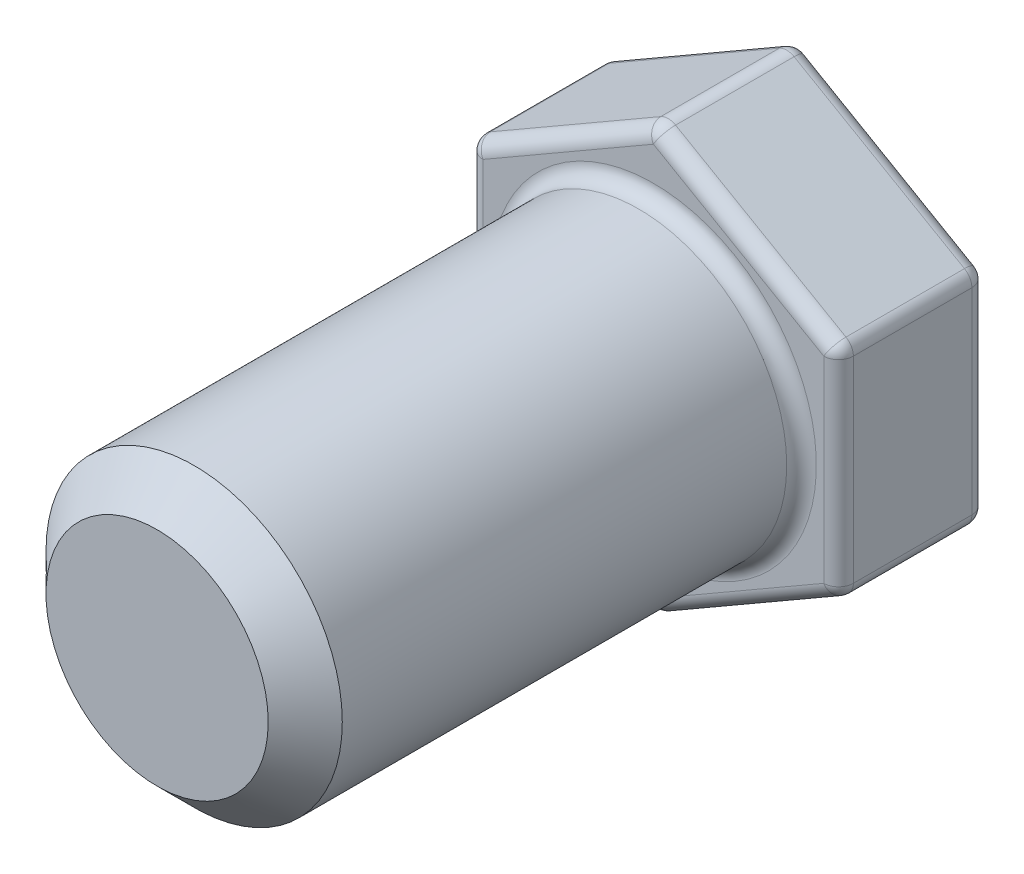
from build123d import *

# Parameters (mm, degrees)
SKETCH1_R           = 2
BOSS_EXTRUDE1_DEPTH = 6.7
BOSS_EXTRUDE2_DEPTH = 2
FILLET1_R           = 0.2
FILLET2_R           = 0.2
CHAMFER1_SIZE       = 0.5


with BuildPart() as part:
    # Sketch1 → Boss-Extrude1 (new body)
    with BuildSketch(Plane.XY):
        Circle(SKETCH1_R)
    extrude(amount=BOSS_EXTRUDE1_DEPTH)

    # Sketch2 → Boss-Extrude2 (add)
    with BuildSketch(Plane(origin=(0, 0, 0), x_dir=(-1, 0, 0), z_dir=(0, 0, -1))):
        Polygon((-2.5, 1.443375673), (-2.5, -1.443375673), (0, -2.886751346), (2.5, -1.443375673), (2.5, 1.443375673), (0, 2.886751346), align=None)
    extrude(amount=BOSS_EXTRUDE2_DEPTH)

    # Fillet1
    fillet1_edges = [part.edges().sort_by_distance(p)[0] for p in [
        (1.25, 2.165063509, 0),
        (2.5, 0, 0),
        (1.25, -2.165063509, 0),
        (-1.25, -2.165063509, 0),
        (-2.5, 0, 0),
        (-1.25, 2.165063509, 0),
        (1.25, 2.165063509, -2),
        (2.5, 0, -2),
        (1.25, -2.165063509, -2),
        (-1.25, -2.165063509, -2),
        (-2.5, 0, -2),
        (-1.25, 2.165063509, -2),
        (-2, 0, 0),
    ]]
    fillet(fillet1_edges, radius=FILLET1_R)

    # Fillet2
    fillet2_edges = [part.edges().sort_by_distance(p)[0] for p in [
        (2.5, -1.443375673, -1),
        (2.5, 1.443375673, -1),
        (0, -2.886751346, -1),
        (-2.5, -1.443375673, -1),
        (-2.5, 1.443375673, -1),
        (0, 2.886751346, -1),
        (-2.436285816, 1.406590271, -0.05362317),
        (-2.436285816, -1.406590271, -0.05362317),
        (0, 2.813180543, -0.05362317),
        (0, -2.813180543, -0.05362317),
        (2.436285816, 1.406590271, -0.05362317),
        (2.436285816, -1.406590271, -0.05362317),
        (0, -2.813180543, -1.94637683),
        (2.436285816, -1.406590271, -1.94637683),
        (-2.436285816, -1.406590271, -1.94637683),
        (2.436285816, 1.406590271, -1.94637683),
        (-2.436285816, 1.406590271, -1.94637683),
        (0, 2.813180543, -1.94637683),
    ]]
    fillet(fillet2_edges, radius=FILLET2_R)

    # Chamfer1
    chamfer1_edges = [part.edges().sort_by_distance(p)[0] for p in [
        (-2, 0, 6.7),
    ]]
    chamfer(chamfer1_edges, length=CHAMFER1_SIZE)


solid = part.part
